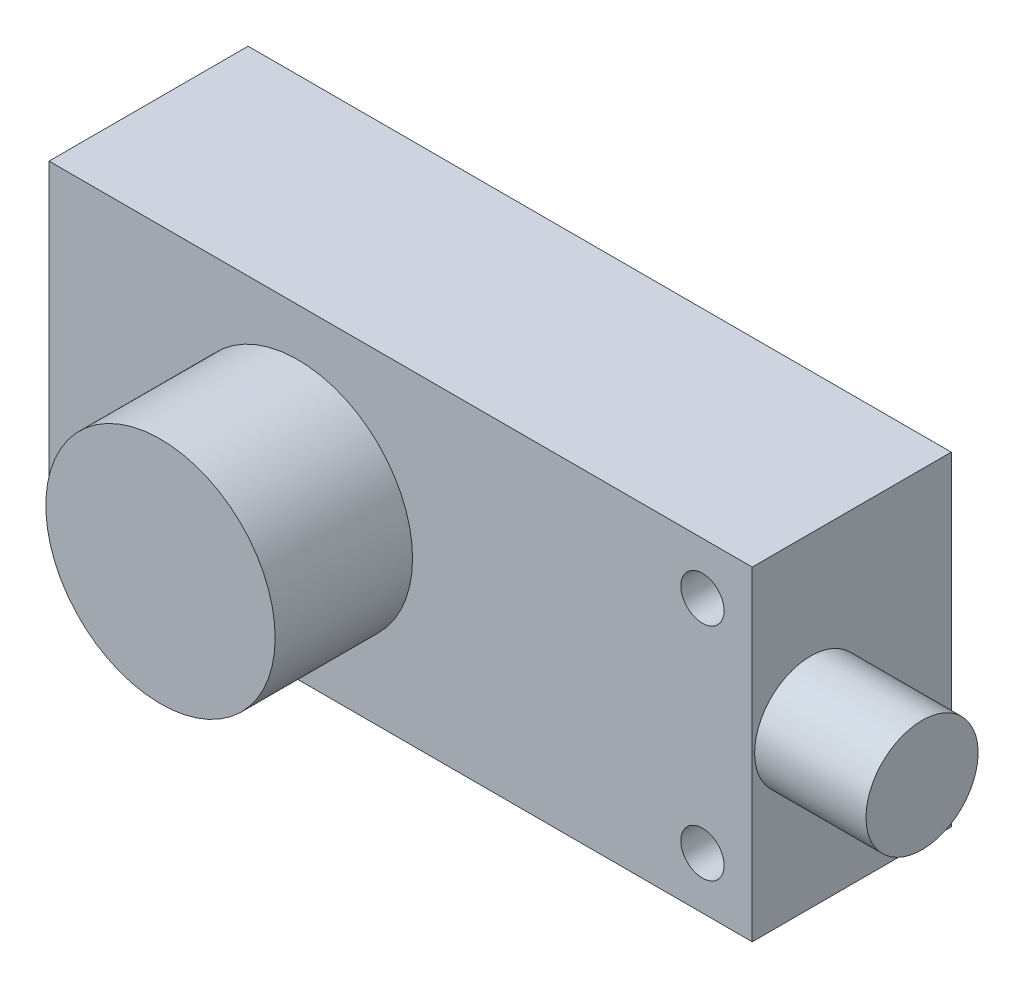
from build123d import *

# Parameters (mm, degrees)
ESQUISSE1_W             = 65
ESQUISSE1_H             = 30
BOSS_EXTRU_1_DEPTH      = 18.4
ESQUISSE2_R             = 10.6
BOSS_EXTRU_2_DEPTH      = 12.7
ESQUISSE4_R             = 2
ENL_V_MAT_EXTRU_2_DEPTH = 41.246863232
ESQUISSE5_R             = 2
ENL_V_MAT_EXTRU_3_DEPTH = 41.246863232
ESQUISSE6_R             = 5.18
BOSS_EXTRU_3_DEPTH      = 10.3


with BuildPart() as part:
    # Esquisse1 → Boss.-Extru.1 (new body)
    with BuildSketch(Plane.XY):
        Rectangle(ESQUISSE1_W, ESQUISSE1_H)
    extrude(amount=BOSS_EXTRU_1_DEPTH)

    # Esquisse2 → Boss.-Extru.2 (add)
    with BuildSketch(Plane.XY.offset(18.4)):
        with Locations((-9.5, 0)):
            Circle(ESQUISSE2_R)
    extrude(amount=BOSS_EXTRU_2_DEPTH)

    # Esquisse4 → Enlèv. mat.-Extru.2 (cut, through all)
    with BuildSketch(Plane.XY.offset(18.4)):
        with Locations((27.9, -10.2)):
            Circle(ESQUISSE4_R)
    extrude(amount=-ENL_V_MAT_EXTRU_2_DEPTH, mode=Mode.SUBTRACT)

    # Esquisse5 → Enlèv. mat.-Extru.3 (cut, through all)
    with BuildSketch(Plane.XY.offset(18.4)):
        with Locations((27.9, 10.2)):
            Circle(ESQUISSE5_R)
    extrude(amount=-ENL_V_MAT_EXTRU_3_DEPTH, mode=Mode.SUBTRACT)

    # Esquisse6 → Boss.-Extru.3 (add)
    with BuildSketch(Plane(origin=(32.5, 0, 0), x_dir=(0, 0, -1), z_dir=(1, 0, 0))):
        with Locations(Location((-13, 0, 0), (0, 0, 180))):
            Circle(ESQUISSE6_R)
    extrude(amount=BOSS_EXTRU_3_DEPTH)


solid = part.part
